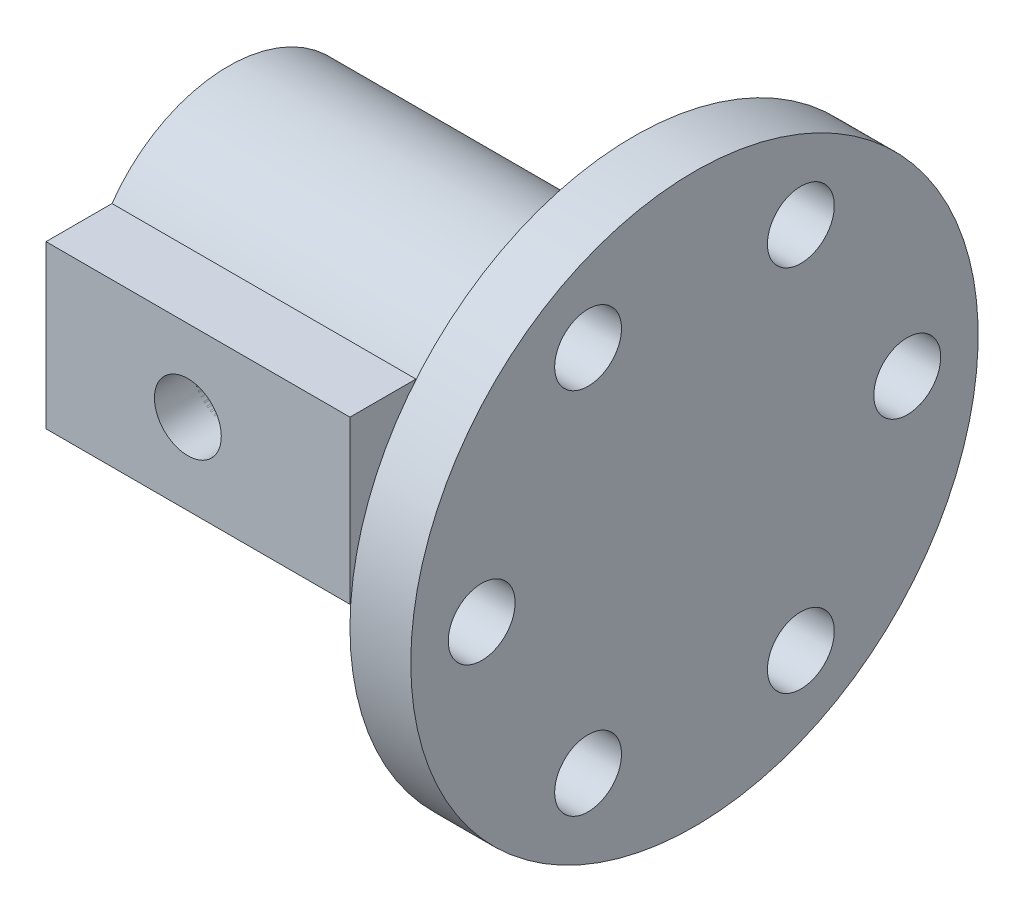
from build123d import *

# Parameters (mm, degrees)
CUT_EXTRUDE1_REACH       = 30.142
SKETCH2_R                = 1.65
SKETCH4_R                = 3.15
CUT_EXTRUDE2_DEPTH       = 13
SKETCH5_R                = 1.65
CUT_EXTRUDE4_DEPTH       = 6
FILLET1_R                = 1
BOSS_EXTRUDE1_DEPTH      = 2
BOSS_EXTRUDE1_DEPTH_BACK = 2
SKETCH6_W                = 15
SKETCH6_H                = 8
SKETCH6_R                = 1.65


with BuildPart() as part:
    # Sketch1 → Revolve1 (revolve)
    with BuildSketch(Plane(origin=(0, 0, 0), x_dir=(1, 0, 0), z_dir=(0, 1, 0))):
        Polygon((0, 0), (0, 7), (20, 7), (20, 14), (23, 14), (23, 0), align=None)
    revolve(axis=Axis((0, 0, 0), (1, 0, 0)))

    # Sketch2 → Cut-Extrude1 (cut, up to next)
    with BuildSketch(Plane.ZY.offset(-20), mode=Mode.PRIVATE) as cut_extrude1_sk1:
        with Locations((10.5, 0)):
            Circle(SKETCH2_R)
    cut_extrude1_tool1 = extrude(cut_extrude1_sk1.sketch, amount=-CUT_EXTRUDE1_REACH, mode=Mode.PRIVATE) & part.part
    # Sketch2 → Cut-Extrude1 (cut, up to next)
    with BuildSketch(Plane.ZY.offset(-20), mode=Mode.PRIVATE) as cut_extrude1_sk2:
        with Locations((5.25, -9.09326674)):
            Circle(SKETCH2_R)
    cut_extrude1_tool2 = extrude(cut_extrude1_sk2.sketch, amount=-CUT_EXTRUDE1_REACH, mode=Mode.PRIVATE) & part.part
    # Sketch2 → Cut-Extrude1 (cut, up to next)
    with BuildSketch(Plane.ZY.offset(-20), mode=Mode.PRIVATE) as cut_extrude1_sk3:
        with Locations((-5.25, -9.09326674)):
            Circle(SKETCH2_R)
    cut_extrude1_tool3 = extrude(cut_extrude1_sk3.sketch, amount=-CUT_EXTRUDE1_REACH, mode=Mode.PRIVATE) & part.part
    # Sketch2 → Cut-Extrude1 (cut, up to next)
    with BuildSketch(Plane.ZY.offset(-20), mode=Mode.PRIVATE) as cut_extrude1_sk4:
        with Locations((-10.5, 0)):
            Circle(SKETCH2_R)
    cut_extrude1_tool4 = extrude(cut_extrude1_sk4.sketch, amount=-CUT_EXTRUDE1_REACH, mode=Mode.PRIVATE) & part.part
    # Sketch2 → Cut-Extrude1 (cut, up to next)
    with BuildSketch(Plane.ZY.offset(-20), mode=Mode.PRIVATE) as cut_extrude1_sk5:
        with Locations((-5.25, 9.09326674)):
            Circle(SKETCH2_R)
    cut_extrude1_tool5 = extrude(cut_extrude1_sk5.sketch, amount=-CUT_EXTRUDE1_REACH, mode=Mode.PRIVATE) & part.part
    # Sketch2 → Cut-Extrude1 (cut, up to next)
    with BuildSketch(Plane.ZY.offset(-20), mode=Mode.PRIVATE) as cut_extrude1_sk6:
        with Locations((5.25, 9.09326674)):
            Circle(SKETCH2_R)
    cut_extrude1_tool6 = extrude(cut_extrude1_sk6.sketch, amount=-CUT_EXTRUDE1_REACH, mode=Mode.PRIVATE) & part.part
    add(cut_extrude1_tool1.solids().sort_by_distance((20, 0, 10.5))[0], mode=Mode.SUBTRACT)
    add(cut_extrude1_tool2.solids().sort_by_distance((20, -9.093267, 5.25))[0], mode=Mode.SUBTRACT)
    add(cut_extrude1_tool3.solids().sort_by_distance((20, -9.093267, -5.25))[0], mode=Mode.SUBTRACT)
    add(cut_extrude1_tool4.solids().sort_by_distance((20, 0, -10.5))[0], mode=Mode.SUBTRACT)
    add(cut_extrude1_tool5.solids().sort_by_distance((20, 9.093267, -5.25))[0], mode=Mode.SUBTRACT)
    add(cut_extrude1_tool6.solids().sort_by_distance((20, 9.093267, 5.25))[0], mode=Mode.SUBTRACT)

    # Sketch4 → Cut-Extrude2 (cut)
    with BuildSketch(Plane.ZY):
        Circle(SKETCH4_R)
    extrude(amount=-CUT_EXTRUDE2_DEPTH, mode=Mode.SUBTRACT)

    # Sketch5 → Cut-Extrude4 (cut)
    with BuildSketch(Plane.XY.offset(7)):
        with Locations((7, 0)):
            Circle(SKETCH5_R)
    extrude(amount=-CUT_EXTRUDE4_DEPTH, mode=Mode.SUBTRACT)

    # Fillet1
    fillet1_edges = [part.edges().sort_by_distance(p)[0] for p in [
        (20, 0, 7),
    ]]
    fillet(fillet1_edges, radius=FILLET1_R)


with BuildPart() as body_2:
    # Sketch6 → Boss-Extrude1 (new, two sides: drawn at the far end of the back side and taken through both)
    with BuildSketch(Plane.XY.offset(7).offset(-BOSS_EXTRUDE1_DEPTH_BACK)):
        with Locations((7.5, 0)):
            Rectangle(SKETCH6_W, SKETCH6_H)
        with Locations((7, 0)):
            Circle(SKETCH6_R, mode=Mode.SUBTRACT)
    extrude(amount=BOSS_EXTRUDE1_DEPTH + BOSS_EXTRUDE1_DEPTH_BACK)


solid = Compound([part.part, body_2.part])
